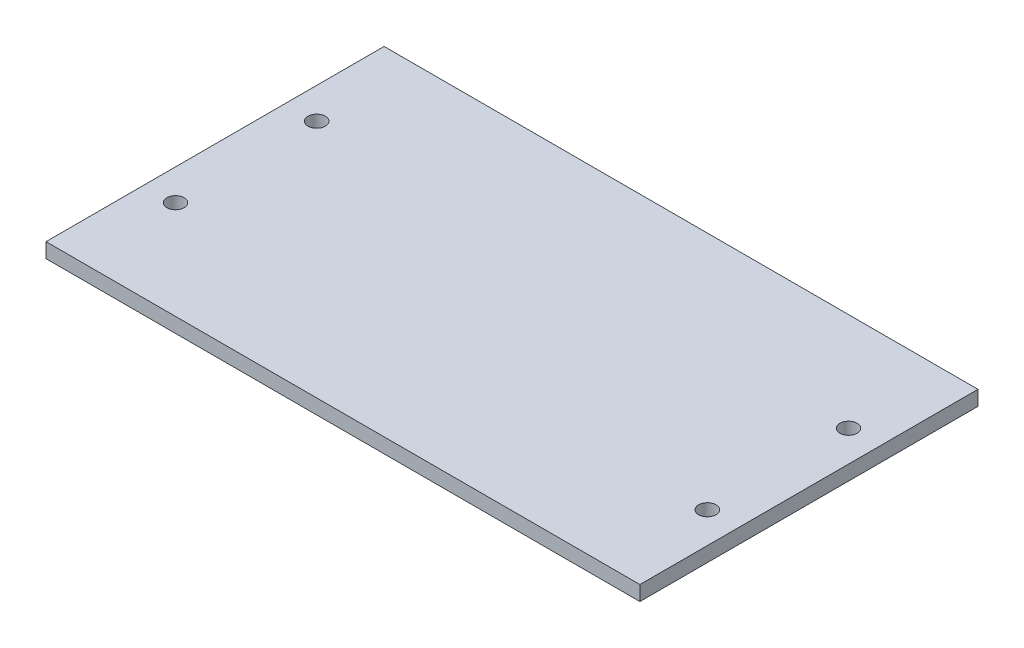
from build123d import *

# Parameters (mm, degrees)
SKETCH1_W           = 191.516
SKETCH1_H           = 109.0295
SKETCH1_R           = 2.794
BOSS_EXTRUDE1_DEPTH = 4.7625


with BuildPart() as part:
    # Sketch1 → Boss-Extrude1 (new body)
    with BuildSketch(Plane(origin=(0, 0, 0), x_dir=(1, 0, 0), z_dir=(0, 1, 0))):
        with Locations((95.758, 54.51475)):
            Rectangle(SKETCH1_W, SKETCH1_H)
        with Locations(Location((10.0076, 77.2795, 0), (0, 0, 90))):
            Circle(SKETCH1_R, mode=Mode.SUBTRACT)
        with Locations(Location((10.0076, 31.75, 0), (0, 0, 90))):
            Circle(SKETCH1_R, mode=Mode.SUBTRACT)
        with Locations(Location((181.5084, 77.2795, 0), (0, 0, 90))):
            Circle(SKETCH1_R, mode=Mode.SUBTRACT)
        with Locations(Location((181.5084, 31.75, 0), (0, 0, 90))):
            Circle(SKETCH1_R, mode=Mode.SUBTRACT)
    extrude(amount=BOSS_EXTRUDE1_DEPTH)


solid = part.part
